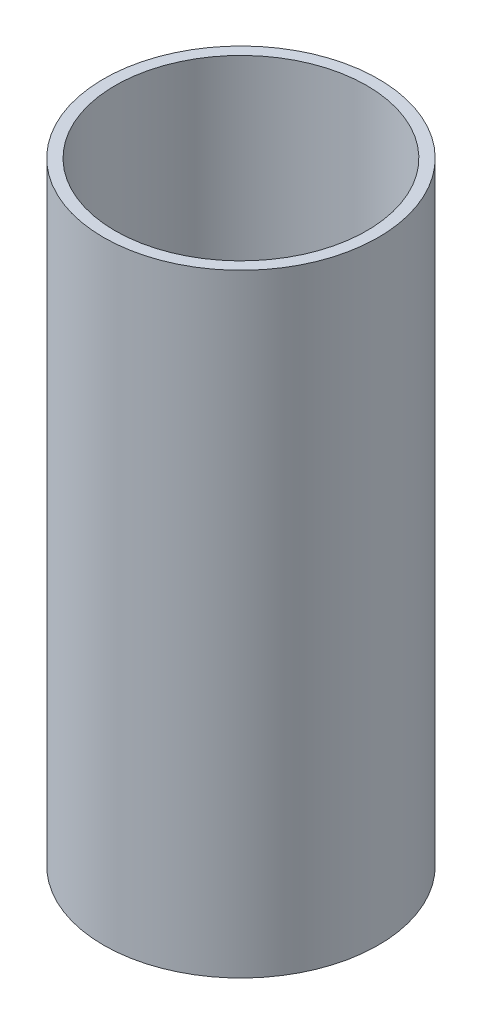
from build123d import *

# Parameters (mm, degrees)
SKETCH1_R           = 19.05
SKETCH1_R_2         = 17.45
BOSS_EXTRUDE1_DEPTH = 85


with BuildPart() as part:
    # Sketch1 → Boss-Extrude1 (new body)
    with BuildSketch(Plane(origin=(0, 0, 0), x_dir=(1, 0, 0), z_dir=(0, 1, 0))):
        with Locations(Location((0, 0, 0), (0, 0, 270))):
            Circle(SKETCH1_R)
        with Locations(Location((0, 0, 0), (0, 0, 270))):
            Circle(SKETCH1_R_2, mode=Mode.SUBTRACT)
    extrude(amount=BOSS_EXTRUDE1_DEPTH)


solid = part.part
